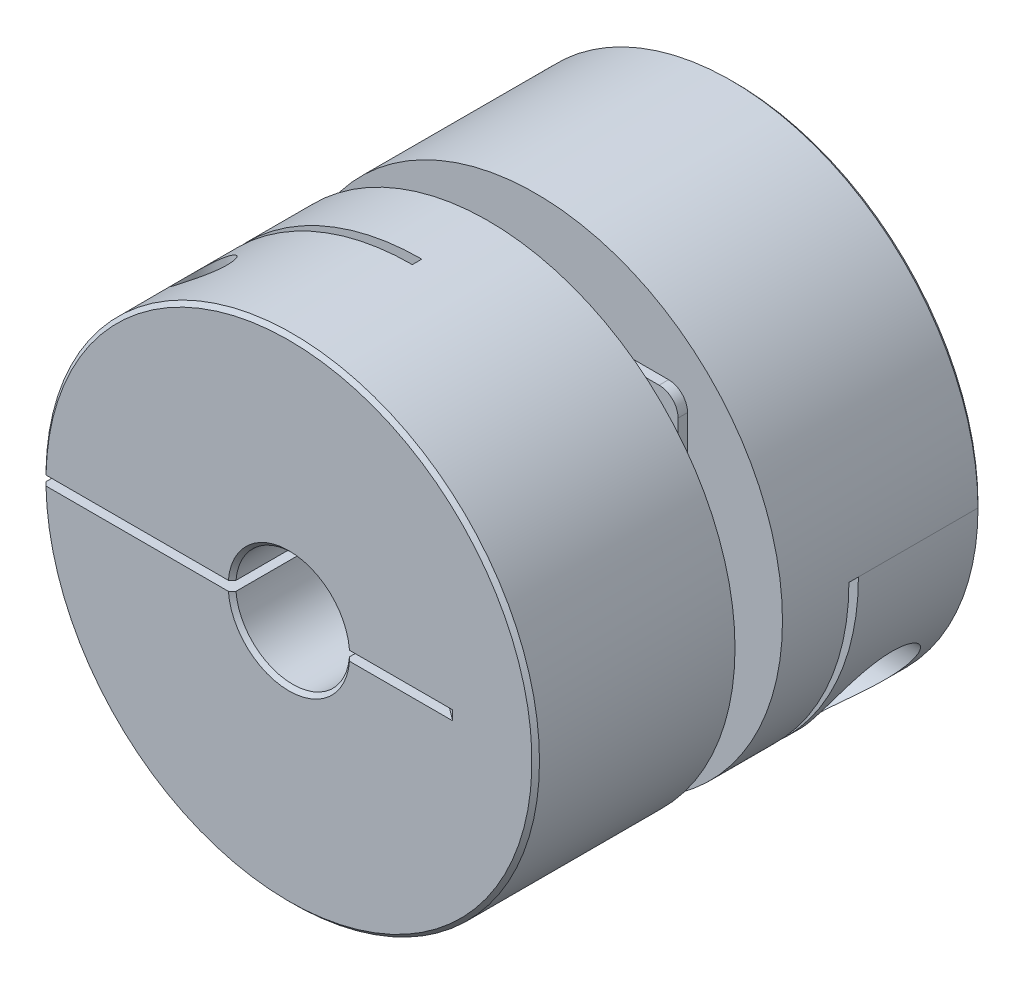
from build123d import *

# Parameters (mm, degrees)
EXTRUDE_1_DEPTH             = 0.25
SKETCH_2_R                  = 1.5
EXTRUDE_2_DEPTH             = 1
SKETCH_4_R                  = 13
EXTRUDE_3_DEPTH             = 10.5
SKETCH_6_R                  = 4
CUT_EXTRUDE_1_DEPTH         = 11.5
SKETCH_7_R                  = 3
CUT_EXTRUDE_2_DEPTH         = 13
SKETCH_9_W                  = 26
SKETCH_9_H                  = 0.5
CUT_EXTRUDE_3_DEPTH         = 22.818856524
SKETCH_10_W                 = 0.5
SKETCH_10_H                 = 26
CUT_EXTRUDE_4_DEPTH         = 22.818856524
CUT_EXTRUDE_5_DEPTH         = 0.25
CUT_EXTRUDE_6_DEPTH         = 0.25
HOLE_WIZARD_2_D             = 3.2
HOLE_WIZARD_2_DEPTH         = 13
HOLE_WIZARD_2_CBORE_D       = 5
HOLE_WIZARD_2_CBORE_DEPTH   = 9
HOLE_WIZARD_2_TIP           = 0.96137699
HOLE_WIZARD_M3_2_D          = 2.5
HOLE_WIZARD_2_2_D           = 3.3
HOLE_WIZARD_2_2_DEPTH       = 13
HOLE_WIZARD_2_2_CBORE_D     = 5
HOLE_WIZARD_2_2_CBORE_DEPTH = 9
HOLE_WIZARD_2_2_TIP         = 0.991420021
HOLE_WIZARD_M3_1_D          = 2.5
CHAMFER_1_SIZE              = 0.2


with BuildPart() as part:
    # 草图1 → 凸台-拉伸1 (new, symmetric)
    with BuildSketch(Plane.XY):
        with BuildLine():
            Line((-8, -9), (8, -9))
            ThreePointArc((8, -9), (8.707106781, -8.707106781), (9, -8))
            Line((9, -8), (9, 8))
            ThreePointArc((9, 8), (8.707106781, 8.707106781), (8, 9))
            Line((8, 9), (-8, 9))
            ThreePointArc((-8, 9), (-8.707106781, 8.707106781), (-9, 8))
            Line((-9, 8), (-9, -8))
            ThreePointArc((-9, -8), (-8.707106781, -8.707106781), (-8, -9))
        make_face()
    extrude(amount=EXTRUDE_1_DEPTH, both=True)

    # 草图2 → 凸台-拉伸2 (add)
    with BuildSketch(Plane.XY.offset(0.25)):
        with Locations((-6.363961031, 6.363961031)):
            Circle(SKETCH_2_R)
        with Locations(Location((6.363961031, 6.363961031, 0), (0, 0, 180))):
            Circle(SKETCH_2_R)
        with Locations((6.363961031, -6.363961031)):
            Circle(SKETCH_2_R)
        with Locations(Location((-6.363961031, -6.363961031, 0), (0, 0, 180))):
            Circle(SKETCH_2_R)
    extrude_2 = extrude(amount=EXTRUDE_2_DEPTH)

    # 草图4 → 凸台-拉伸3 (add)
    with BuildSketch(Plane.XY.offset(1.25)):
        with Locations(Location((0, 0, 0), (0, 0, 180))):
            Circle(SKETCH_4_R)
    extrude_3 = extrude(amount=EXTRUDE_3_DEPTH)

    # 镜向1: 凸台-拉伸2, 凸台-拉伸3 across plane
    add(extrude_2.mirror(Plane.XY))
    add(extrude_3.mirror(Plane.XY))

    # 草图6 → 切除-拉伸1 (cut)
    with BuildSketch(Plane(origin=(0, 0, -11.75), x_dir=(-1, 0, 0), z_dir=(0, 0, -1))):
        Circle(SKETCH_6_R)
    extrude(amount=-CUT_EXTRUDE_1_DEPTH, mode=Mode.SUBTRACT)

    # 草图7 → 切除-拉伸2 (cut)
    with BuildSketch(Plane.XY.offset(11.75)):
        Circle(SKETCH_7_R)
    extrude(amount=-CUT_EXTRUDE_2_DEPTH, mode=Mode.SUBTRACT)

    # 草图9 → 切除-拉伸3 (cut, through all)
    with BuildSketch(Plane(origin=(0, 0, 0), x_dir=(1, 0, 0), z_dir=(0, 1, 0))):
        with Locations((0, 5)):
            Rectangle(SKETCH_9_W, SKETCH_9_H)
    extrude(amount=-CUT_EXTRUDE_3_DEPTH, mode=Mode.SUBTRACT)

    # 草图10 → 切除-拉伸4 (cut, through all)
    with BuildSketch(Plane(origin=(0, 0, 0), x_dir=(0, 0, -1), z_dir=(1, 0, 0))):
        with Locations((-5, 0)):
            Rectangle(SKETCH_10_W, SKETCH_10_H)
    extrude(amount=-CUT_EXTRUDE_4_DEPTH, mode=Mode.SUBTRACT)

    # 草图11 → 切除-拉伸5 (cut, symmetric)
    with BuildSketch(Plane(origin=(0, 0, 0), x_dir=(1, 0, 0), z_dir=(0, 1, 0))):
        Polygon((0, -5.25), (8.625791341, -11.75), (-13, -11.75), (-13, -5.25), align=None)
    extrude(amount=CUT_EXTRUDE_5_DEPTH, both=True, mode=Mode.SUBTRACT)

    # 草图12 → 切除-拉伸6 (cut, symmetric)
    with BuildSketch(Plane(origin=(0, 0, 0), x_dir=(0, 0, -1), z_dir=(1, 0, 0))):
        Polygon((5.25, 0), (5.25, -13), (11.75, -13), (11.75, 8.625791341), align=None)
    extrude(amount=CUT_EXTRUDE_6_DEPTH, both=True, mode=Mode.SUBTRACT)

    # Hole Wizard 2
    with Locations(Plane(origin=(13, 0, 0), x_dir=(0, 0, -1), z_dir=(1, 0, 0))):
        with Locations((8.25, -8)):
            CounterBoreHole(HOLE_WIZARD_2_D / 2, HOLE_WIZARD_2_CBORE_D / 2, HOLE_WIZARD_2_CBORE_DEPTH, depth=HOLE_WIZARD_2_DEPTH)
            with Locations((0, 0, -(HOLE_WIZARD_2_DEPTH + HOLE_WIZARD_2_TIP / 2))):  # 118° drill point
                Cone(0, HOLE_WIZARD_2_D / 2, HOLE_WIZARD_2_TIP, mode=Mode.SUBTRACT)

    # M3 螺纹孔2 (through all)
    with Locations(Plane(origin=(-0.25, 0, 0), x_dir=(0, 0, -1), z_dir=(1, 0, 0))):
        with Locations((8.25, -8)):
            Hole(HOLE_WIZARD_M3_2_D / 2)

    # Hole Wizard 2 2
    with Locations(Plane.XZ.offset(13)):
        with Locations((-8, 8.25)):
            CounterBoreHole(HOLE_WIZARD_2_2_D / 2, HOLE_WIZARD_2_2_CBORE_D / 2, HOLE_WIZARD_2_2_CBORE_DEPTH, depth=HOLE_WIZARD_2_2_DEPTH)
            with Locations((0, 0, -(HOLE_WIZARD_2_2_DEPTH + HOLE_WIZARD_2_2_TIP / 2))):  # 118° drill point
                Cone(0, HOLE_WIZARD_2_2_D / 2, HOLE_WIZARD_2_2_TIP, mode=Mode.SUBTRACT)

    # M3 螺纹孔1 (through all)
    with Locations(Plane(origin=(0, 0.25, 0), x_dir=(-1, 0, 0), z_dir=(0, -1, 0))):
        with Locations((8, -8.25)):
            Hole(HOLE_WIZARD_M3_1_D / 2)

    # 倒角1
    chamfer_1_edges = [part.edges().sort_by_distance(p)[0] for p in [
        (0, -3, 11.75),
        (13, 0, 11.75),
        (4, 0, -11.75),
        (-2.915475947, 2.738612788, -11.75),
        (9.103570728, 9.280355597, -11.75),
        (0, 3, 11.75),
    ]]
    chamfer(chamfer_1_edges, length=CHAMFER_1_SIZE)


solid = part.part
